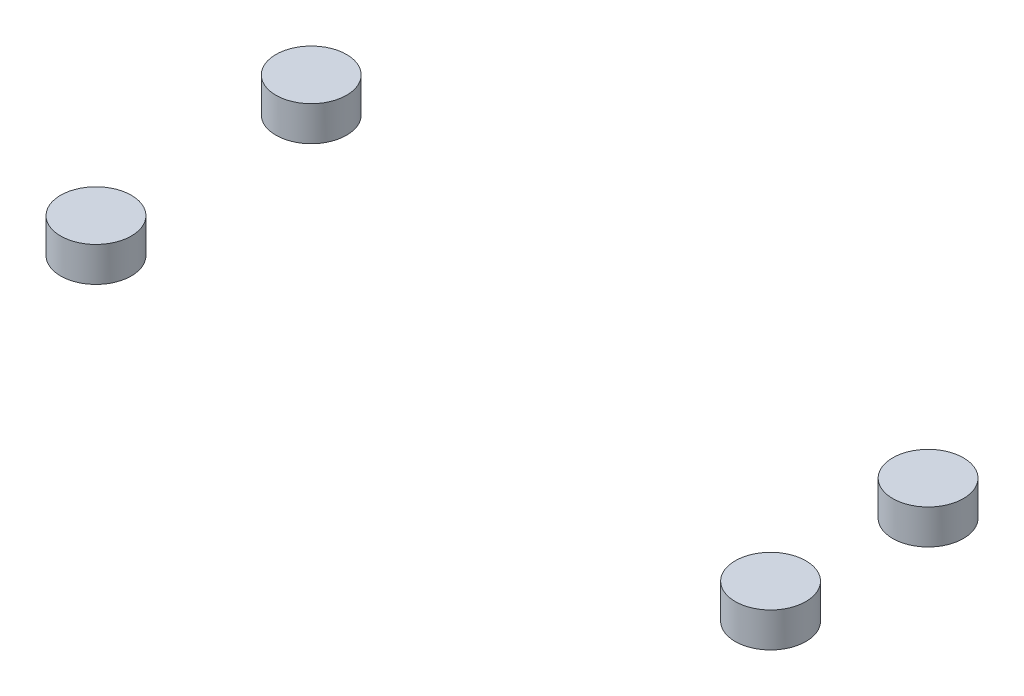
from build123d import *

# Parameters (mm, degrees)
SKETCH3_R             = 8.001
BOSS_EXTRUDE1_DEPTH   = 7.8486
BOSS_EXTRUDE1_2_DEPTH = 7.8486
BOSS_EXTRUDE1_3_DEPTH = 7.8486
BOSS_EXTRUDE1_4_DEPTH = 7.8486


with BuildPart() as part:
    # Sketch3 → Boss-Extrude1 (new body)
    with BuildSketch(Plane(origin=(0, 0, 0), x_dir=(1, 0, 0), z_dir=(0, 1, 0))):
        with Locations(Location((70.365028008, 22.068010378, 0), (0, 0, 90))):
            Circle(SKETCH3_R)
    extrude(amount=BOSS_EXTRUDE1_DEPTH)


with BuildPart() as body_2:
    # Sketch3 → Boss-Extrude1 2 (new body)
    with BuildSketch(Plane(origin=(0, 0, 0), x_dir=(1, 0, 0), z_dir=(0, 1, 0))):
        with Locations(Location((72.727349085, -15.959525946, 0), (0, 0, 90))):
            Circle(SKETCH3_R)
    extrude(amount=BOSS_EXTRUDE1_2_DEPTH)


with BuildPart() as body_3:
    # Sketch3 → Boss-Extrude1 3 (new body)
    with BuildSketch(Plane(origin=(0, 0, 0), x_dir=(1, 0, 0), z_dir=(0, 1, 0))):
        with Locations(Location((-78.551654853, 31.318912558, 0), (0, 0, 90))):
            Circle(SKETCH3_R)
    extrude(amount=BOSS_EXTRUDE1_3_DEPTH)


with BuildPart() as body_4:
    # Sketch3 → Boss-Extrude1 4 (new body)
    with BuildSketch(Plane(origin=(0, 0, 0), x_dir=(1, 0, 0), z_dir=(0, 1, 0))):
        with Locations(Location((-75.323149381, -20.652053752, 0), (0, 0, 90))):
            Circle(SKETCH3_R)
    extrude(amount=BOSS_EXTRUDE1_4_DEPTH)


solid = Compound([part.part, body_2.part, body_3.part, body_4.part])
